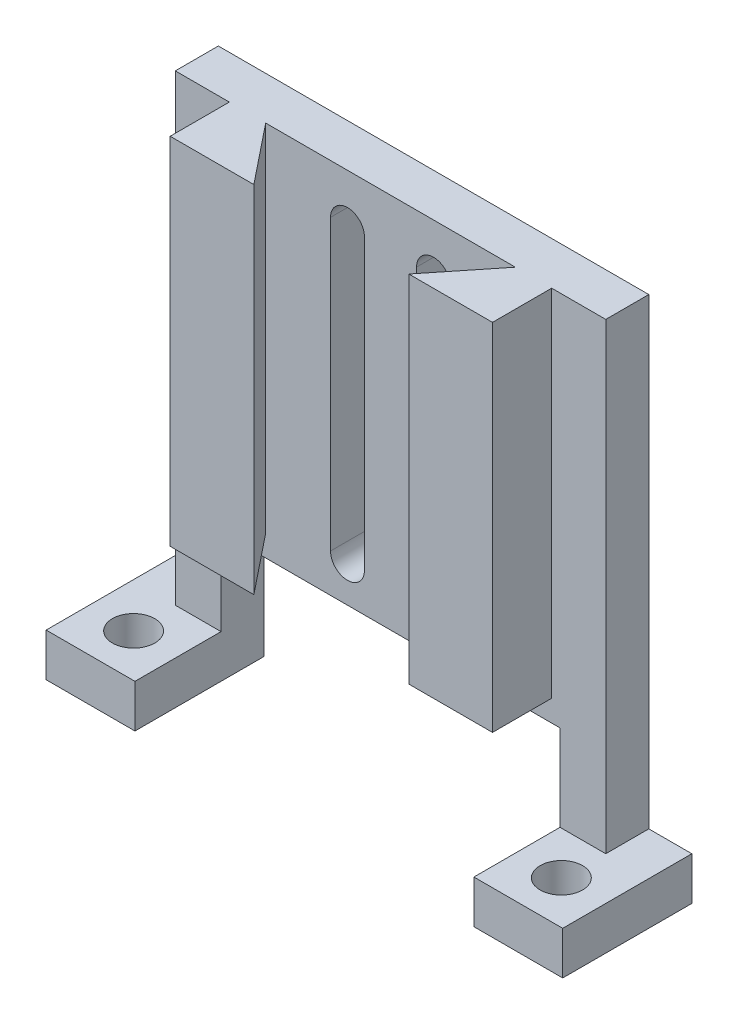
from build123d import *

# Parameters (mm, degrees)
SKETCH1_W               = 50.8
SKETCH1_H               = 54.61
BOSS_EXTRUDE1_DEPTH     = 5.08
BOSS_EXTRUDE2_DEPTH     = 54.61
CUT_EXTRUDE1_DEPTH      = 75.911162886
CUT_EXTRUDE1_DEPTH_BACK = 5.08
SKETCH4_W               = 50.8
SKETCH4_H               = 15.24
BOSS_EXTRUDE3_DEPTH     = 5.08
CUT_EXTRUDE2_REACH      = 74.025
SKETCH5_W               = 6.985
SKETCH5_H               = 12.7
CUT_EXTRUDE3_START      = -15.24
SKETCH6_W               = 40
SKETCH6_H               = 15.24
CUT_EXTRUDE3_DEPTH      = 15.24
SKETCH8_W               = 15.24
SKETCH8_H               = 5.08
BOSS_EXTRUDE4_DEPTH     = 5.08
SKETCH9_R               = 2.5
CUT_EXTRUDE4_DEPTH      = 5.08


with BuildPart() as part:
    # Sketch1 → Boss-Extrude1 (new body)
    with BuildSketch(Plane.XY):
        with Locations((25.4, 27.305)):
            Rectangle(SKETCH1_W, SKETCH1_H)
    extrude(amount=BOSS_EXTRUDE1_DEPTH)

    # Sketch2 → Boss-Extrude2 (add)
    with BuildSketch(Plane.XZ):
        Polygon((10.668, 5.08), (6.380565044, 5.08), (6.380565044, 12.065), (16.256, 12.065), align=None)
        Polygon((34.544, 12.065), (40.132, 5.08), (44.419434956, 5.08), (44.419434956, 12.065), align=None)
    extrude(amount=-BOSS_EXTRUDE2_DEPTH)

    # Sketch3 → Cut-Extrude1 (cut, two sides: drawn at the far end of the back side and taken through both)
    with BuildSketch(Plane.XY.offset(5.08).offset(-CUT_EXTRUDE1_DEPTH_BACK)):
        with BuildLine():
            Line((22.32, 48.8), (22.32, 14.7))
            ThreePointArc((22.32, 14.7), (20.32, 12.7), (18.32, 14.7))
            Line((18.32, 14.7), (18.32, 48.8))
            ThreePointArc((18.32, 48.8), (20.32, 50.8), (22.32, 48.8))
        make_face()
        with BuildLine():
            Line((28.48, 48.8), (28.48, 14.7))
            ThreePointArc((28.48, 14.7), (30.48, 12.7), (32.48, 14.7))
            Line((32.48, 14.7), (32.48, 48.8))
            ThreePointArc((32.48, 48.8), (30.48, 50.8), (28.48, 48.8))
        make_face()
    extrude(amount=CUT_EXTRUDE1_DEPTH + CUT_EXTRUDE1_DEPTH_BACK, mode=Mode.SUBTRACT)

    # Sketch4 → Boss-Extrude3 (add)
    with BuildSketch(Plane.XZ):
        with Locations((25.4, 7.62)):
            Rectangle(SKETCH4_W, SKETCH4_H)
    extrude(amount=BOSS_EXTRUDE3_DEPTH)

    # Cut-Extrude2: up to this face of the body (flat: up to its plane)
    cut_extrude2_end = Plane(part.part.faces().sort_by_distance((44.419434956, 27.305, 8.5725))[0])
    # Sketch5 → Cut-Extrude2 (cut, up to the picked face)
    with BuildSketch(Plane.ZY.offset(-6.380565044), mode=Mode.PRIVATE) as cut_extrude2_sk1:
        with Locations((8.5725, 6.35)):
            Rectangle(SKETCH5_W, SKETCH5_H)
    cut_extrude2_tool1 = split(extrude(cut_extrude2_sk1.sketch, amount=-CUT_EXTRUDE2_REACH, mode=Mode.PRIVATE), bisect_by=cut_extrude2_end, keep=Keep.BOTH, mode=Mode.PRIVATE)
    add(cut_extrude2_tool1.solids().sort_by(Axis((6.380565, 6.35, 8.5725), (1, 0, 0)))[0], mode=Mode.SUBTRACT)

    # Sketch6 → Cut-Extrude3 (cut)
    with BuildSketch(Plane.XY.offset(15.24).offset(CUT_EXTRUDE3_START)):
        with Locations((25.4, 2.54)):
            Rectangle(SKETCH6_W, SKETCH6_H)
    extrude(amount=CUT_EXTRUDE3_DEPTH, mode=Mode.SUBTRACT)

    # Sketch8 → Boss-Extrude4 (add)
    with BuildSketch(Plane.ZY):
        with Locations((7.62, -2.54)):
            Rectangle(SKETCH8_W, SKETCH8_H)
    boss_extrude4 = extrude(amount=BOSS_EXTRUDE4_DEPTH)

    # Mirror1: Boss-Extrude4 across plane
    add(boss_extrude4.mirror(Plane.ZY.offset(-25.4)))

    # Sketch9 → Cut-Extrude4 (cut)
    with BuildSketch(Plane(origin=(0, 0, 0), x_dir=(1, 0, 0), z_dir=(0, 1, 0))):
        with Locations(Location((0.16, -10.16, 0), (0, 0, 270))):
            Circle(SKETCH9_R)
        with Locations(Location((50.64, -10.16, 0), (0, 0, 90))):
            Circle(SKETCH9_R)
    extrude(amount=-CUT_EXTRUDE4_DEPTH, mode=Mode.SUBTRACT)


solid = part.part
